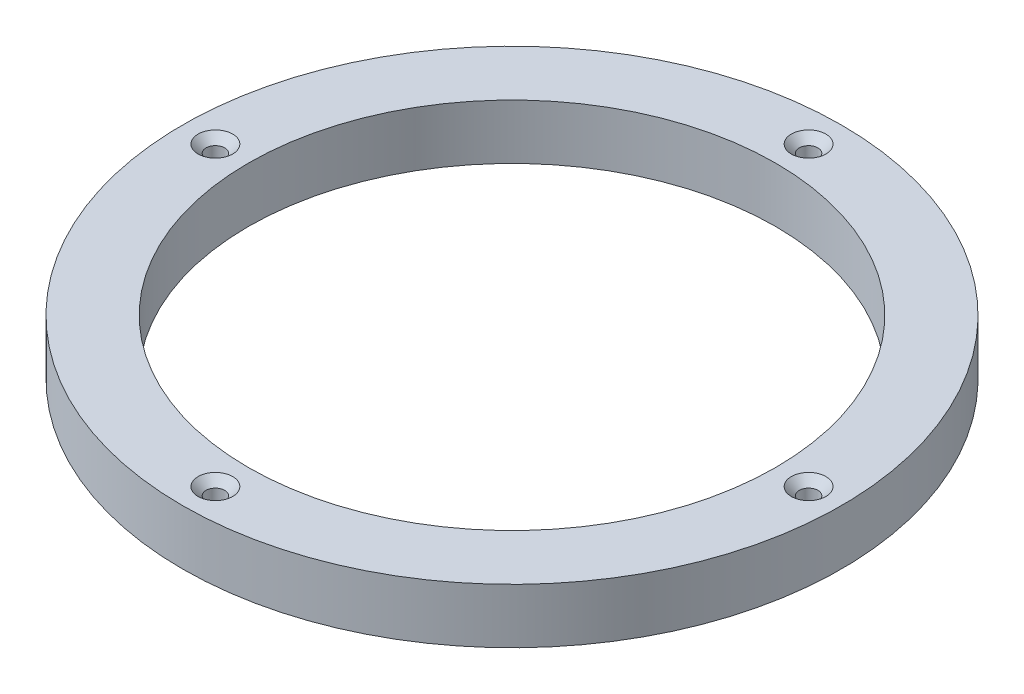
from build123d import *

# Parameters (mm, degrees)
SCHIZZO1_R                             = 60
SCHIZZO1_R_2                           = 48
ESTRUSIONE_ESTRUSIONE1_DEPTH           = 10
FORO_SVASATO_PER_VITE_M3_1_D           = 3.4
FORO_SVASATO_PER_VITE_M3_1_DEPTH       = 188
FORO_SVASATO_PER_VITE_M3_1_CSINK_D     = 6.3
FORO_SVASATO_PER_VITE_M3_1_CSINK_ANGLE = 90
FORO_SVASATO_PER_VITE_M3_1_TIP         = 1.021463052


with BuildPart() as part:
    # Schizzo1 → Estrusione-Estrusione1 (new body)
    with BuildSketch(Plane(origin=(0, 0, 0), x_dir=(1, 0, 0), z_dir=(0, 1, 0))):
        with Locations(Location((0, 0, 0), (0, 0, 270))):
            Circle(SCHIZZO1_R)
        with Locations(Location((0, 0, 0), (0, 0, 270))):
            Circle(SCHIZZO1_R_2, mode=Mode.SUBTRACT)
    extrude(amount=ESTRUSIONE_ESTRUSIONE1_DEPTH)

    # Foro svasato per Vite M3-1
    with Locations(Plane(origin=(0, 10, 54), x_dir=(0, 0, 1), z_dir=(0, 1, 0))):
        with Locations((0, 0), (-54, 54), (-108, 0), (-54, -54)):
            CounterSinkHole(FORO_SVASATO_PER_VITE_M3_1_D / 2, FORO_SVASATO_PER_VITE_M3_1_CSINK_D / 2, depth=FORO_SVASATO_PER_VITE_M3_1_DEPTH, counter_sink_angle=FORO_SVASATO_PER_VITE_M3_1_CSINK_ANGLE)
            with Locations((0, 0, -(FORO_SVASATO_PER_VITE_M3_1_DEPTH + FORO_SVASATO_PER_VITE_M3_1_TIP / 2))):  # 118° drill point
                Cone(0, FORO_SVASATO_PER_VITE_M3_1_D / 2, FORO_SVASATO_PER_VITE_M3_1_TIP, mode=Mode.SUBTRACT)


solid = part.part
